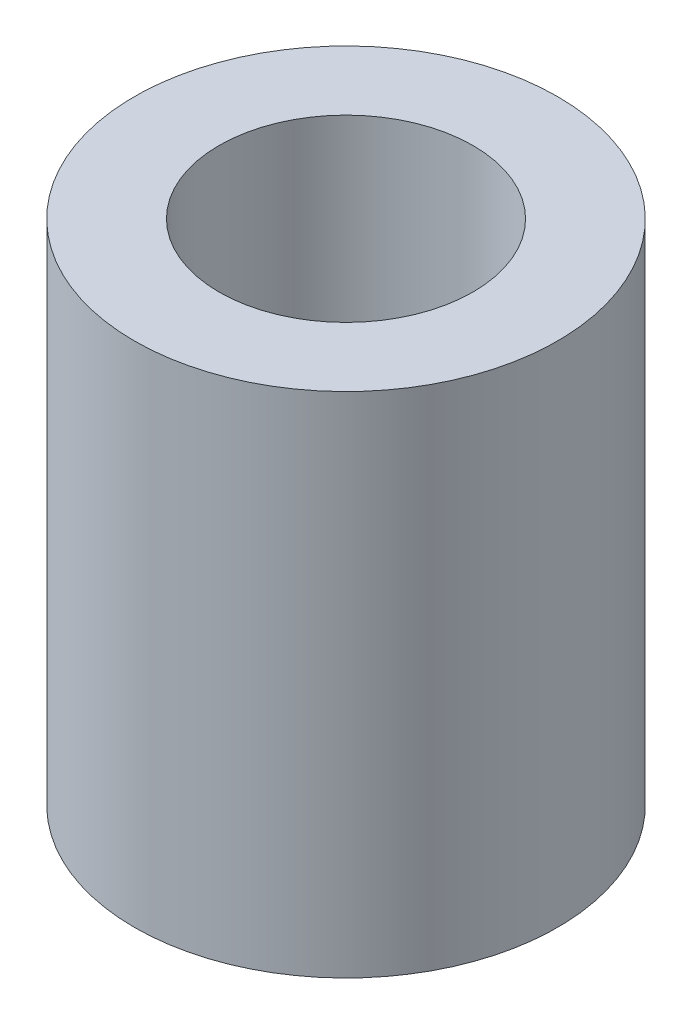
from build123d import *

# Parameters (mm, degrees)
SKETCH1_R           = 15.875
SKETCH1_R_2         = 9.525
BOSS_EXTRUDE1_DEPTH = 38.1


with BuildPart() as part:
    # Sketch1 → Boss-Extrude1 (new body)
    with BuildSketch(Plane(origin=(0, 0, 0), x_dir=(1, 0, 0), z_dir=(0, 1, 0))):
        with Locations(Location((0, 0, 0), (0, 0, 270))):
            Circle(SKETCH1_R)
        with Locations(Location((0, 0, 0), (0, 0, 270))):
            Circle(SKETCH1_R_2, mode=Mode.SUBTRACT)
    extrude(amount=BOSS_EXTRUDE1_DEPTH)


solid = part.part
